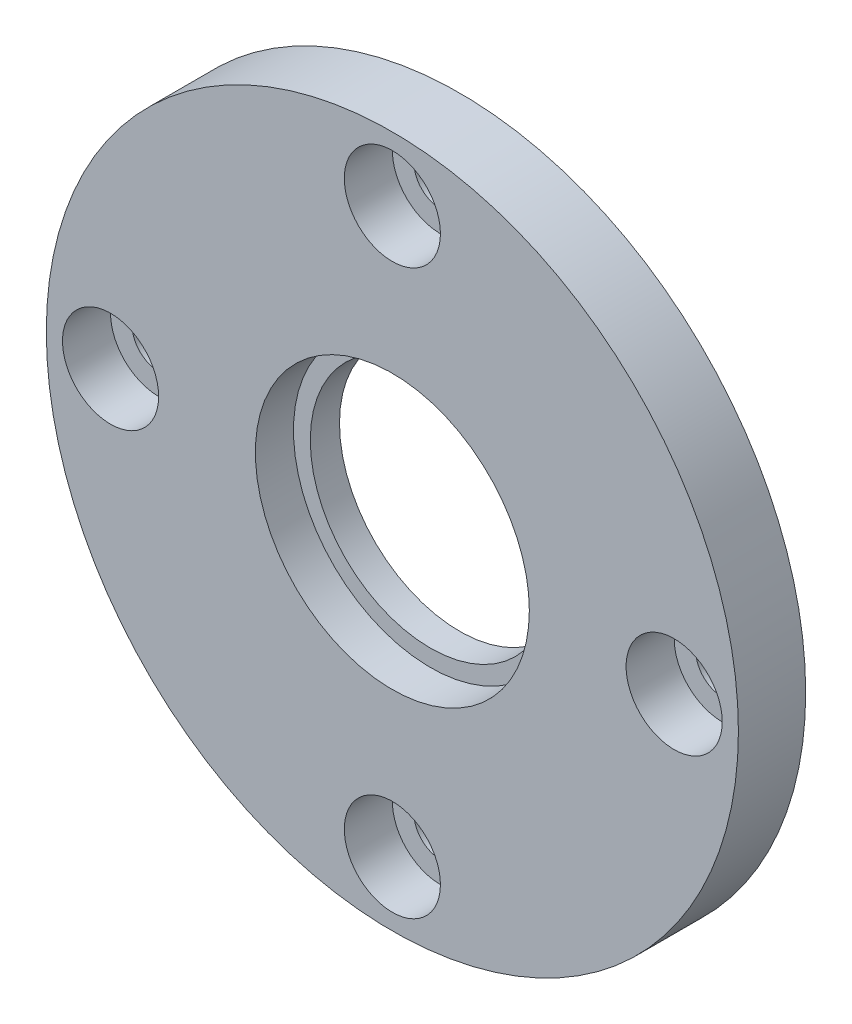
from build123d import *

# Parameters (mm, degrees)
SKETCH1_W                      = 7
SKETCH1_H                      = 26.5
SKETCH2_R                      = 12.5
SHAFT_THRU_DEPTH               = 52.39066063
CBORE_FOR_M5_SHCS1_D           = 5.5
CBORE_FOR_M5_SHCS1_CBORE_D     = 10
CBORE_FOR_M5_SHCS1_CBORE_DEPTH = 5
CIRPATTERN1_COUNT              = 4
SKETCH5_R                      = 14.25
SEAL_SEAT_DEPTH                = 3.9624


with BuildPart() as part:
    # Sketch1 → Main_body (revolve)
    with BuildSketch(Plane(origin=(0, 0, 0), x_dir=(0, 0, -1), z_dir=(1, 0, 0)), mode=Mode.PRIVATE) as main_body_sk:
        with Locations((-139.159, -22.75)):
            Rectangle(SKETCH1_W, SKETCH1_H)
        with Locations((-139.159, 22.75)):
            Rectangle(SKETCH1_W, SKETCH1_H)
    revolve(main_body_sk.sketch.rotate(Axis((0, 0, 1000), (0, 0, -1)), 270), axis=Axis((0, 0, 1000), (0, 0, -1)))

    # Sketch2 → Shaft_thru (cut, through all)
    with BuildSketch(Plane(origin=(0, 0, 135.659), x_dir=(-1, 0, 0), z_dir=(0, 0, -1))):
        Circle(SKETCH2_R)
    extrude(amount=-SHAFT_THRU_DEPTH, mode=Mode.SUBTRACT)

    # CBORE for M5 SHCS1 (through all)
    with Locations(Plane.XY.offset(142.659)):
        with Locations((0, 29.3156)):
            cbore_for_m5_shcs1 = CounterBoreHole(CBORE_FOR_M5_SHCS1_D / 2, CBORE_FOR_M5_SHCS1_CBORE_D / 2, CBORE_FOR_M5_SHCS1_CBORE_DEPTH)

    # CirPattern1: CBORE for M5 SHCS1 ×4 about axis
    cirpattern1_axis = Axis((0, 0, 0), (0, 0, 1))
    for i in range(1, CIRPATTERN1_COUNT):
        add(cbore_for_m5_shcs1.rotate(cirpattern1_axis, i * 360 / CIRPATTERN1_COUNT), mode=Mode.SUBTRACT)

    # Sketch5 → seal_seat (cut)
    with BuildSketch(Plane.XY.offset(142.659)):
        Circle(SKETCH5_R)
    extrude(amount=-SEAL_SEAT_DEPTH, mode=Mode.SUBTRACT)


solid = part.part
